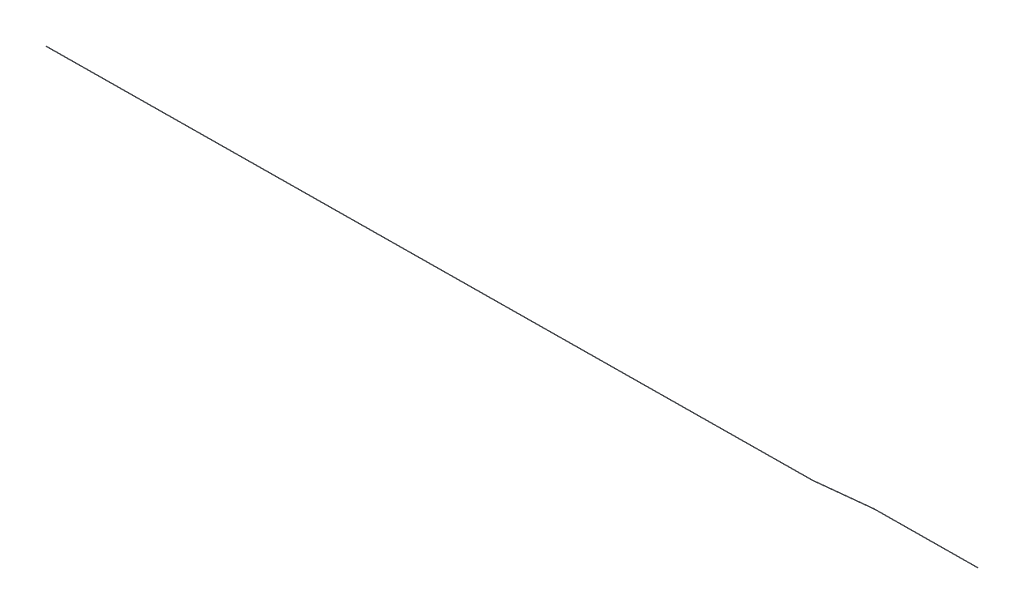
from build123d import *

# Parameters (mm, degrees)
SWEEP1_PROFILE_R = 0.15


with BuildPart() as part:
    # Sweep1: sweep along a curve in space
    with BuildLine() as sweep1_path:
        Line((-387.158080085, -7.565015268, -0.791581331), (276.632908472, -1.85332665, -1.409870972))
        Line((324.253923799, -2.06444239, -6.816048745), (276.632908472, -1.85332665, -1.409870972))
        Line((324.253923799, -2.06444239, -6.816048745), (413.924770547, -1.585607768, -7.116038179))
    # Sweep1 profile (on start of the path) → Sweep1 (sweep)
    with BuildSketch(Plane(origin=(-387.158080085, -7.565015268, -0.791581331), x_dir=(-0.008604330702830724, 0.9999629820614143, 0), z_dir=(0.9999625483081791, 0.008604326970536284, -0.0009314174127303236))):
        Circle(SWEEP1_PROFILE_R)
    sweep(path=sweep1_path.line, transition=Transition.RIGHT)


solid = part.part
